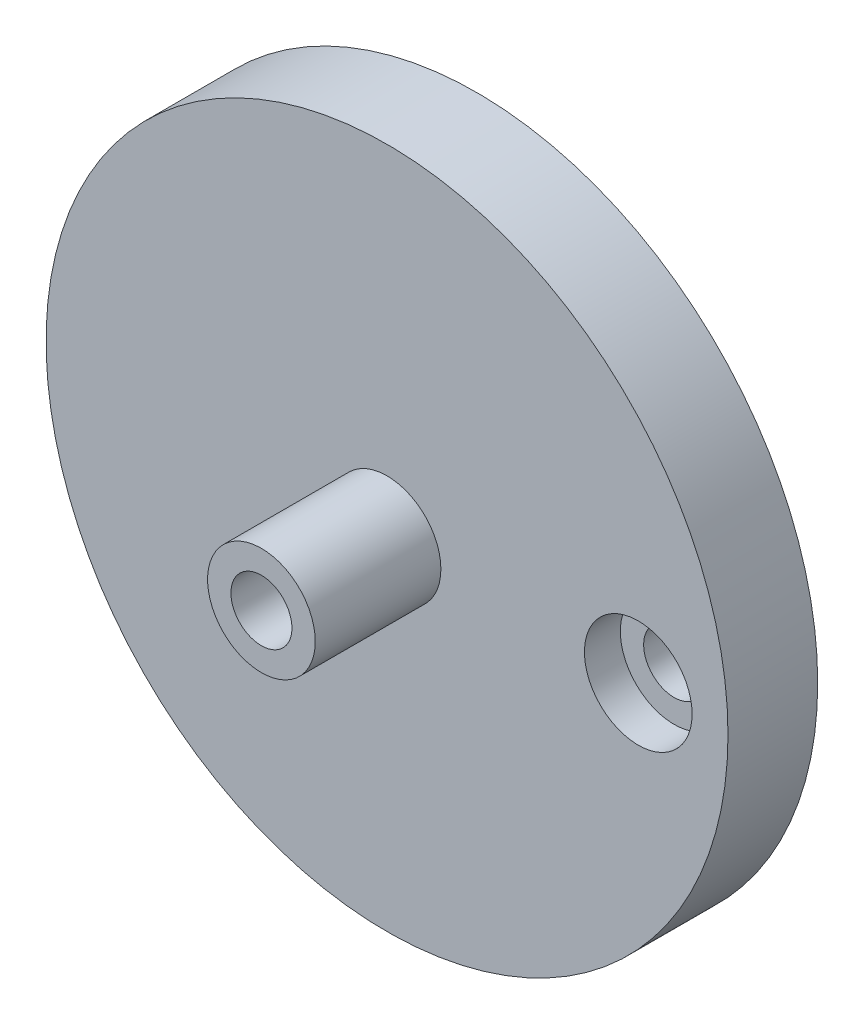
from build123d import *

# Parameters (mm, degrees)
SKETCH1_R               = 19
BOSS_EXTRUDE1_DEPTH     = 5
SKETCH2_R               = 3
BOSS_EXTRUDE2_DEPTH     = 7
SKETCH3_R               = 1.7
CUT_EXTRUDE1_DEPTH      = 30.427877939
SKETCH4_R               = 3
CUT_EXTRUDE2_DEPTH      = 2
CUT_EXTRUDE3_DEPTH      = 30.427877939
CUT_EXTRUDE3_DEPTH_BACK = 30.427877939
SKETCH5_R               = 1.7
SKETCH6_R               = 3
CUT_EXTRUDE4_DEPTH      = 2


with BuildPart() as part:
    # Sketch1 → Boss-Extrude1 (new body)
    with BuildSketch(Plane(origin=(0, 0, 0), x_dir=(0, 1, 0), z_dir=(0, 0, 1))):
        with Locations(Location((0, 0, 0), (0, 0, 270))):
            Circle(SKETCH1_R)
    extrude(amount=BOSS_EXTRUDE1_DEPTH)

    # Sketch2 → Boss-Extrude2 (add)
    with BuildSketch(Plane.XY.offset(5)):
        Circle(SKETCH2_R)
    extrude(amount=BOSS_EXTRUDE2_DEPTH)

    # Sketch3 → Cut-Extrude1 (cut, through all)
    with BuildSketch(Plane.XY.offset(12)):
        Circle(SKETCH3_R)
    extrude(amount=-CUT_EXTRUDE1_DEPTH, mode=Mode.SUBTRACT)

    # Sketch4 → Cut-Extrude2 (cut)
    with BuildSketch(Plane(origin=(0, 0, 0), x_dir=(1, 0, 0), z_dir=(0, 0, -1))):
        Circle(SKETCH4_R)
    extrude(amount=-CUT_EXTRUDE2_DEPTH, mode=Mode.SUBTRACT)

    # Sketch5 → Cut-Extrude3 (cut, two sides: drawn at the far end of the back side and taken through both)
    with BuildSketch(Plane(origin=(0, 0, 0), x_dir=(1, 0, 0), z_dir=(0, 0, -1)).offset(-CUT_EXTRUDE3_DEPTH_BACK)):
        with Locations((14, 0)):
            Circle(SKETCH5_R)
    extrude(amount=CUT_EXTRUDE3_DEPTH + CUT_EXTRUDE3_DEPTH_BACK, mode=Mode.SUBTRACT)

    # Sketch6 → Cut-Extrude4 (cut)
    with BuildSketch(Plane.XY.offset(5)):
        with Locations((14, 0)):
            Circle(SKETCH6_R)
    extrude(amount=-CUT_EXTRUDE4_DEPTH, mode=Mode.SUBTRACT)


solid = part.part
